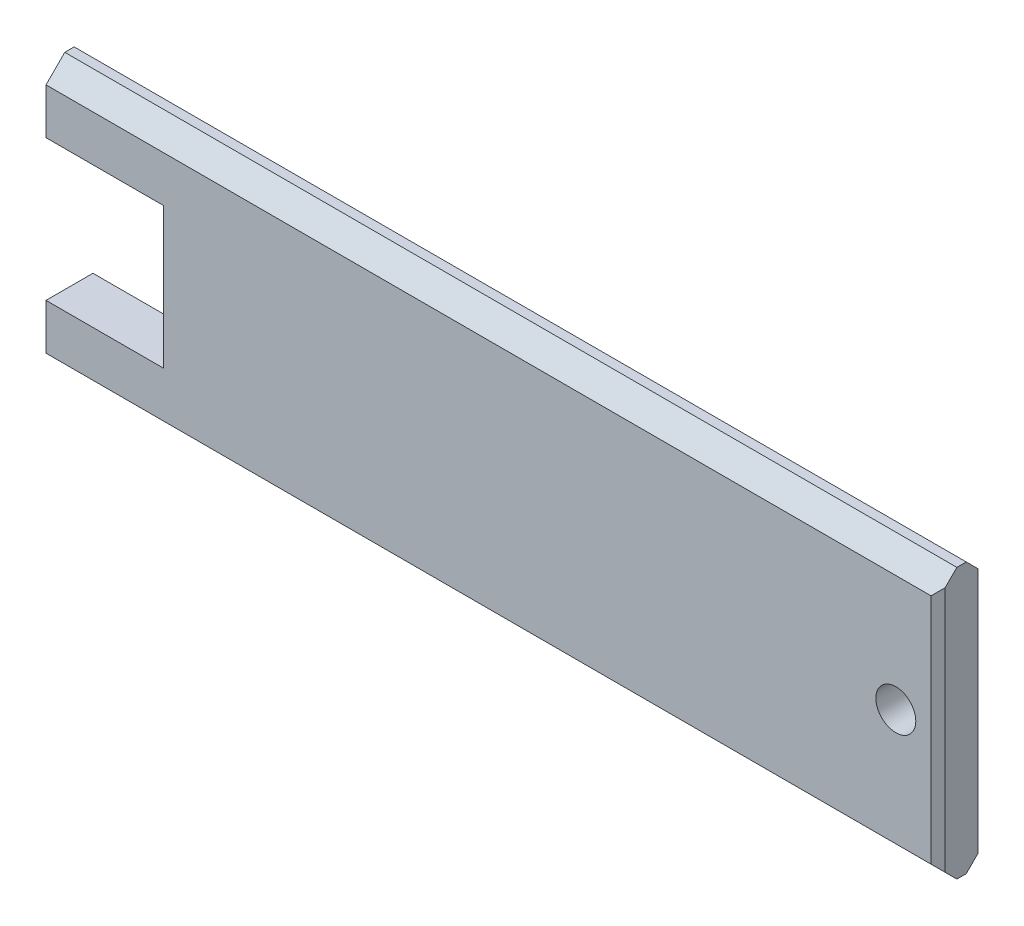
from build123d import *

# Parameters (mm, degrees)
SKETCH_1_W          = 380
SKETCH_1_H          = 115
EXTRUDE_1_DEPTH     = 20
SKETCH_2_R          = 8.5
CUT_EXTRUDE_1_DEPTH = 20
CHAMFER_1_SIZE      = 3
SKETCH_3_W          = 50
SKETCH_3_H          = 60
CUT_EXTRUDE_2_DEPTH = 200.515037027
CHAMFER_2_SIZE      = 8


with BuildPart() as part:
    # 草图1 → 凸台-拉伸1 (new body)
    with BuildSketch(Plane.XY):
        Rectangle(SKETCH_1_W, SKETCH_1_H)
    extrude(amount=EXTRUDE_1_DEPTH)

    # 草图2 → 切除-拉伸1 (cut)
    with BuildSketch(Plane.XY.offset(20)):
        with Locations((172, 0)):
            Circle(SKETCH_2_R)
    extrude(amount=-CUT_EXTRUDE_1_DEPTH, mode=Mode.SUBTRACT)

    # 倒角1
    chamfer_1_edges = [part.edges().sort_by_distance(p)[0] for p in [
        (190, 0, 20),
        (190, 0, 0),
    ]]
    chamfer(chamfer_1_edges, length=CHAMFER_1_SIZE)

    # 草图3 → 切除-拉伸2 (cut, through all)
    with BuildSketch(Plane.XY.offset(20)):
        with Locations((-165, 0)):
            Rectangle(SKETCH_3_W, SKETCH_3_H)
    extrude(amount=-CUT_EXTRUDE_2_DEPTH, mode=Mode.SUBTRACT)

    # 倒角2
    chamfer_2_edges = [part.edges().sort_by_distance(p)[0] for p in [
        (-1.5, 57.5, 20),
        (-1.5, 57.5, 0),
        (-1.5, -57.5, 0),
        (-1.5, -57.5, 20),
    ]]
    chamfer(chamfer_2_edges, length=CHAMFER_2_SIZE)


solid = part.part
